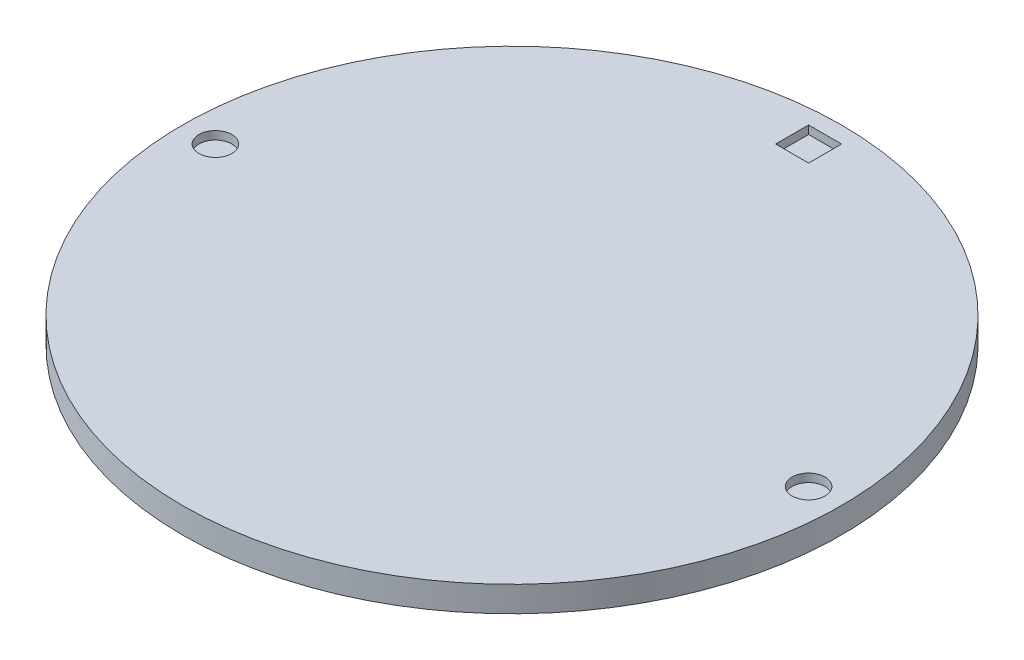
from build123d import *

# Parameters (mm, degrees)
BOSS_EXTRUDE1_DEPTH      = 1
BOSS_EXTRUDE1_DEPTH_BACK = 30
SKETCH1_R                = 400
SKETCH2_R                = 20
SKETCH2_W                = 40
SKETCH2_H                = 40
CUT_EXTRUDE1_DEPTH       = 10


with BuildPart() as part:
    # Sketch1 → Boss-Extrude1 (new, two sides: drawn at the far end of the back side and taken through both)
    with BuildSketch(Plane(origin=(0, 0, 0), x_dir=(1, 0, 0), z_dir=(0, 1, 0)).offset(-BOSS_EXTRUDE1_DEPTH_BACK)):
        with Locations(Location((0, 0, 0), (0, 0, 270))):
            Circle(SKETCH1_R)
    extrude(amount=BOSS_EXTRUDE1_DEPTH + BOSS_EXTRUDE1_DEPTH_BACK)

    # Sketch2 → Cut-Extrude1 (cut)
    with BuildSketch(Plane(origin=(0, 1, 0), x_dir=(1, 0, 0), z_dir=(0, 1, 0))):
        with Locations(Location((-360, 0, 0), (0, 0, 270))):
            Circle(SKETCH2_R)
        with Locations(Location((360, 0, 0), (0, 0, 270))):
            Circle(SKETCH2_R)
        with Locations((0, 360)):
            Rectangle(SKETCH2_W, SKETCH2_H)
    extrude(amount=-CUT_EXTRUDE1_DEPTH, mode=Mode.SUBTRACT)


solid = part.part
